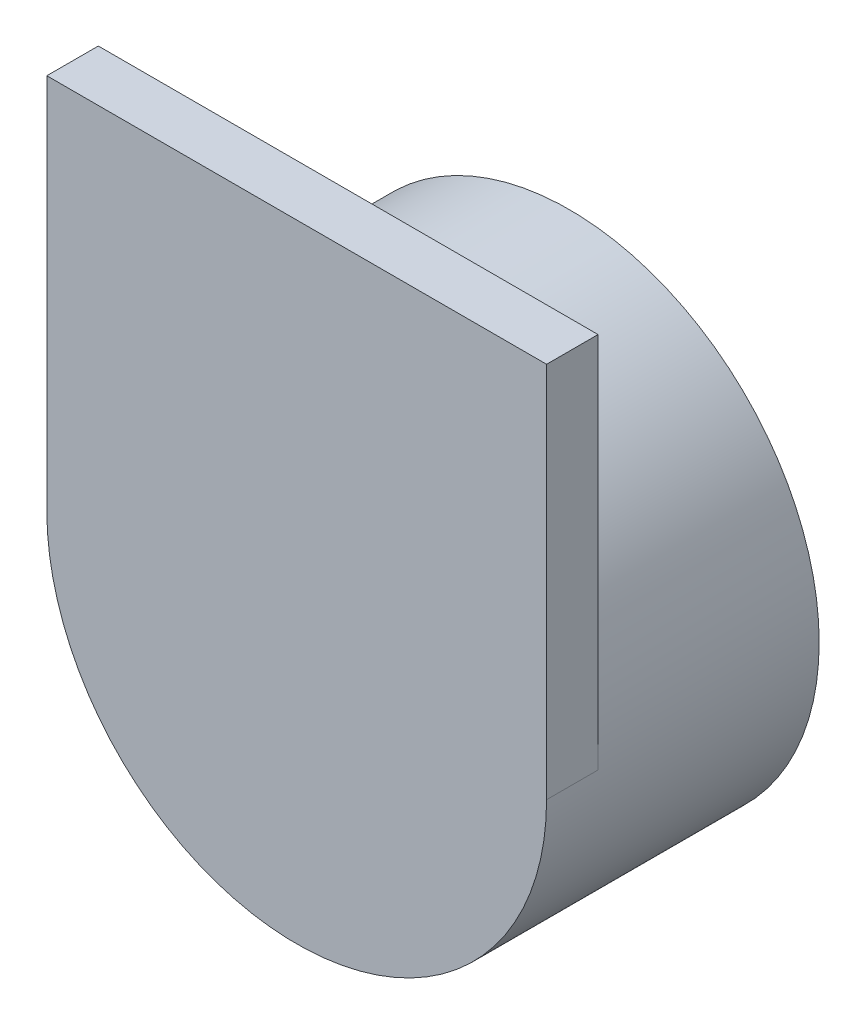
from build123d import *

# Parameters (mm, degrees)
SKETCH1_R           = 8.25
BOSS_EXTRUDE1_DEPTH = 9
SKETCH2_W           = 16.5
SKETCH2_H           = 12.45
BOSS_EXTRUDE2_DEPTH = 1.7


with BuildPart() as part:
    # Sketch1 → Boss-Extrude1 (new body)
    with BuildSketch(Plane.XY):
        Circle(SKETCH1_R)
    extrude(amount=BOSS_EXTRUDE1_DEPTH)

    # Sketch2 → Boss-Extrude2 (add)
    with BuildSketch(Plane.XY.offset(9)):
        with Locations((0, 6.225)):
            Rectangle(SKETCH2_W, SKETCH2_H)
    extrude(amount=-BOSS_EXTRUDE2_DEPTH)


solid = part.part
